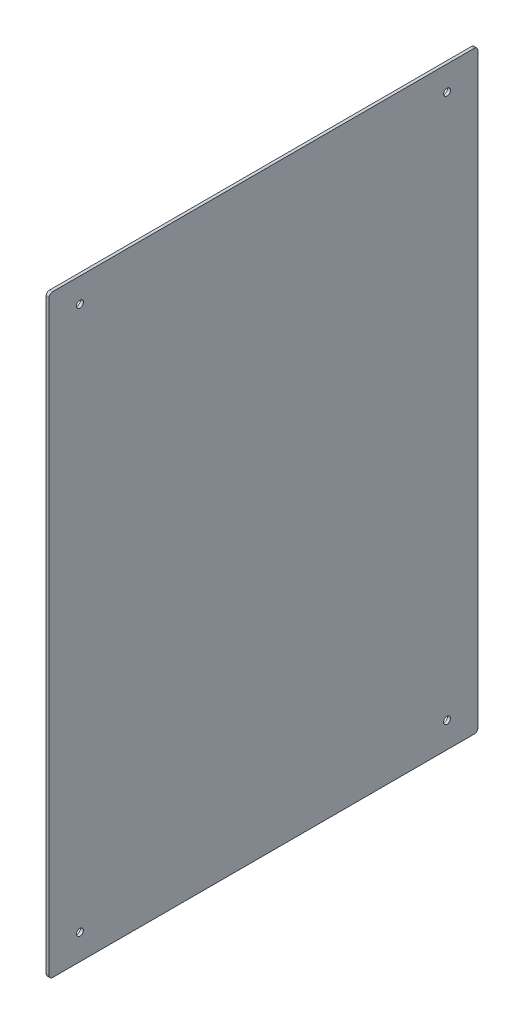
from build123d import *

# Parameters (mm, degrees)
SKETCH_1_W      = 188
SKETCH_1_H      = 260.5
SKETCH_1_R      = 1.5
EXTRUDE_2_DEPTH = 1.3
FILLET_1_R      = 1.5


with BuildPart() as part:
    # 草图1 → 凸台-拉伸2 (new body)
    with BuildSketch(Plane(origin=(0, 0, 0), x_dir=(0, 0, -1), z_dir=(1, 0, 0))):
        with Locations((94, 130.25)):
            Rectangle(SKETCH_1_W, SKETCH_1_H)
        with Locations((174.5, 249.8)):
            Circle(SKETCH_1_R, mode=Mode.SUBTRACT)
        with Locations((174.5, 11.2)):
            Circle(SKETCH_1_R, mode=Mode.SUBTRACT)
        with Locations((13.5, 249.8)):
            Circle(SKETCH_1_R, mode=Mode.SUBTRACT)
        with Locations((13.5, 11.2)):
            Circle(SKETCH_1_R, mode=Mode.SUBTRACT)
    extrude(amount=EXTRUDE_2_DEPTH)

    # 圆角1
    fillet_1_edges = [part.edges().sort_by_distance(p)[0] for p in [
        (0.65, 260.5, 0),
        (0.65, 260.5, -188),
        (0.65, 0, -188),
        (0.65, 0, 0),
    ]]
    fillet(fillet_1_edges, radius=FILLET_1_R)


solid = part.part
